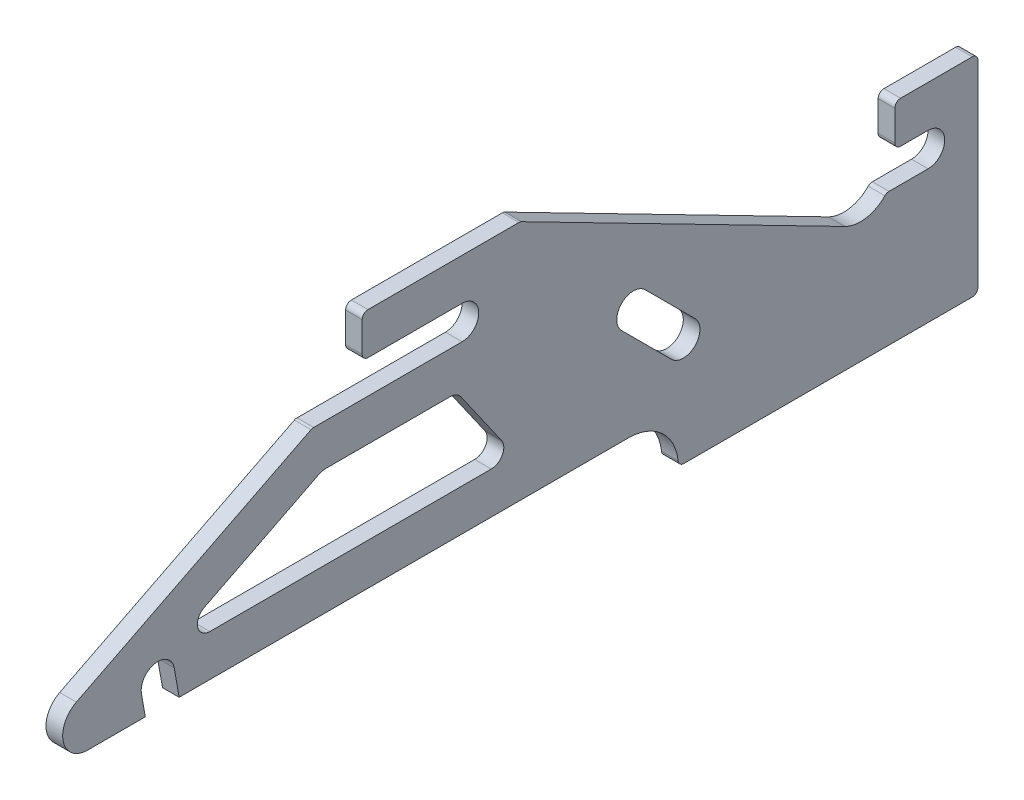
from build123d import *

# Parameters (mm, degrees)
RESSALTO_EXTRUS_O1_DEPTH = 2
CORTE_EXTRUS_O1_DEPTH    = 116.451288429


with BuildPart() as part:
    # Esboço1 → Ressalto-extrusão1 (new body)
    with BuildSketch(Plane(origin=(0, 0, 0), x_dir=(0, 0, -1), z_dir=(1, 0, 0))):
        with BuildLine():
            Line((0, 24.303568951), (0, 0.696431049))
            ThreePointArc((0, 0.696431049), (-0.203979932, 0.203979932), (-0.696431049, 0))
            Line((-0.696431049, 0), (-35.339881939, 0))
            ThreePointArc((-35.339881939, 0), (-35.806022669, 0.179005667), (-36.032536425, 0.624001989))
            ThreePointArc((-36.032536425, 0.624001989), (-37.984032615, 4.457802818), (-42, 6))
            Line((-42, 6), (-96, 6))
            Line((-96, 6), (-96.59021866, 9.347296355))
            ThreePointArc((-96.59021866, 9.347296355), (-98.907130521, 10.969615506), (-100.529449672, 8.652703645))
            Line((-100.529449672, 8.652703645), (-100.061706448, 6))
            Line((-100.061706448, 6), (-107, 6))
            ThreePointArc((-107, 6), (-109.918324731, 8.304744102), (-108.352654988, 11.677746157))
            Line((-108.352654988, 11.677746157), (-80.148093958, 25.925190806))
            ThreePointArc((-80.148093958, 25.925190806), (-79.995482912, 25.981039602), (-79.834083648, 26))
            Line((-79.834083648, 26), (-62, 26))
            ThreePointArc((-62, 26), (-60, 28), (-62, 30))
            Line((-62, 30), (-73.303568951, 30))
            ThreePointArc((-73.303568951, 30), (-73.796020068, 30.203979932), (-74, 30.696431049))
            Line((-74, 30.696431049), (-74, 34.303568951))
            ThreePointArc((-74, 34.303568951), (-73.796020068, 34.796020068), (-73.303568951, 35))
            Line((-73.303568951, 35), (-55.168160729, 35))
            ThreePointArc((-55.168160729, 35), (-55.004697711, 34.980544614), (-54.850367647, 34.92326546))
            Line((-54.850367647, 34.92326546), (-16, 15))
            ThreePointArc((-16, 15), (-13.465644125, 14.602459282), (-11.191291491, 15.789185206))
            ThreePointArc((-11.191291491, 15.789185206), (-10.963040008, 15.945135177), (-10.692099084, 16))
            Line((-10.692099084, 16), (-6, 16))
            ThreePointArc((-6, 16), (-4, 18), (-6, 20))
            Line((-6, 20), (-9.303568951, 20))
            ThreePointArc((-9.303568951, 20), (-9.796020068, 20.203979932), (-10, 20.696431049))
            Line((-10, 20.696431049), (-10, 24.303568951))
            ThreePointArc((-10, 24.303568951), (-9.796020068, 24.796020068), (-9.303568951, 25))
            Line((-9.303568951, 25), (-0.696431049, 25))
            ThreePointArc((-0.696431049, 25), (-0.203979932, 24.796020068), (0, 24.303568951))
        make_face()
        with BuildLine():
            Line((-92.308809913, 11), (-58.486017578, 11))
            ThreePointArc((-58.486017578, 11), (-57.155549564, 11.807284429), (-57.257169698, 13.360193517))
            Line((-57.257169698, 13.360193517), (-62.157169698, 20.360193517))
            ThreePointArc((-62.157169698, 20.360193517), (-62.693302007, 20.830468014), (-63.386017578, 21))
            Line((-63.386017578, 21), (-78.451452887, 21))
            ThreePointArc((-78.451452887, 21), (-78.799080836, 20.959162366), (-79.127780381, 20.838873079))
            Line((-79.127780381, 20.838873079), (-92.985137407, 13.838873079))
            ThreePointArc((-92.985137407, 13.838873079), (-93.767972278, 12.152372051), (-92.308809913, 11))
        make_face(mode=Mode.SUBTRACT)
    extrude(amount=RESSALTO_EXTRUS_O1_DEPTH)

    # Esboço2 → Corte-extrusão1 (cut, through all)
    with BuildSketch(Plane(origin=(2, 0, 0), x_dir=(0, 0, -1), z_dir=(1, 0, 0))):
        with BuildLine():
            Line((-40, 20.414213562), (-34, 14.414213562))
            ThreePointArc((-34, 14.414213562), (-34, 11.585786438), (-36.828427125, 11.585786438))
            Line((-36.828427125, 11.585786438), (-42.828427125, 17.585786438))
            ThreePointArc((-42.828427125, 17.585786438), (-42.828427125, 20.414213562), (-40, 20.414213562))
        make_face()
    extrude(amount=-CORTE_EXTRUS_O1_DEPTH, mode=Mode.SUBTRACT)


solid = part.part
